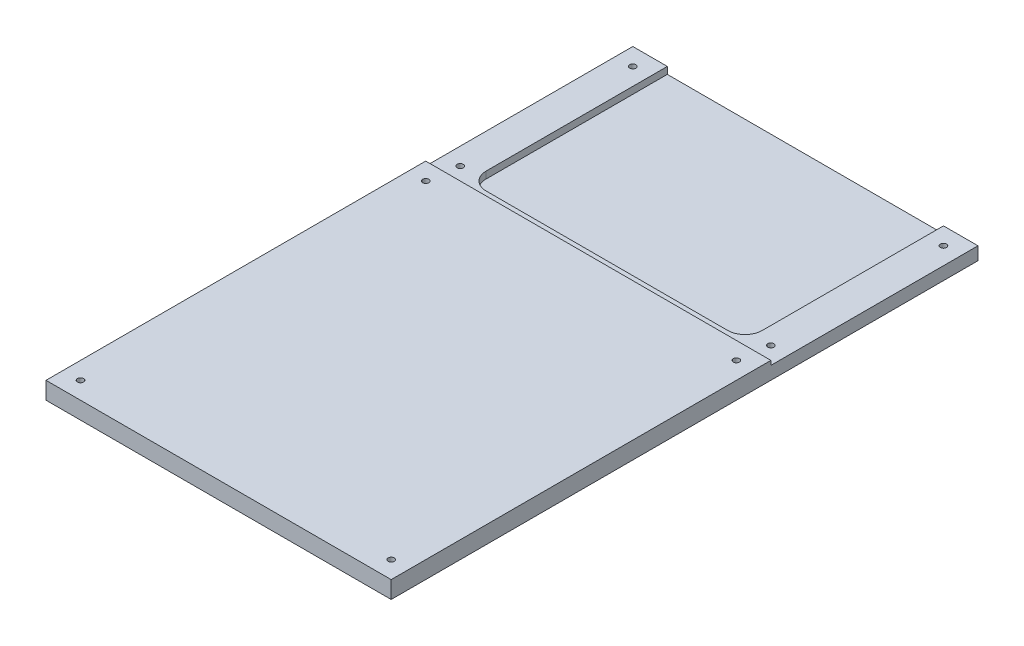
from build123d import *

# Parameters (mm, degrees)
SKETCH1_W                   = 127
SKETCH1_H                   = 215.9
BOSS_EXTRUDE1_DEPTH         = 6.35
SKETCH3_W                   = 127
SKETCH3_H                   = 76.2
CUT_EXTRUDE1_DEPTH          = 1.5875
F_43_0_089_DIAMETER_HOLE1_D = 2.2606
F_43_0_089_DIAMETER_HOLE2_D = 2.2606
SKETCH8_W                   = 101.6
SKETCH8_H                   = 73.025
CUT_EXTRUDE2_DEPTH          = 2.54
FILLET1_R                   = 6.35


with BuildPart() as part:
    # Sketch1 → Boss-Extrude1 (new body)
    with BuildSketch(Plane(origin=(0, 0, 0), x_dir=(1, 0, 0), z_dir=(0, 1, 0))):
        with Locations((63.5, 107.95)):
            Rectangle(SKETCH1_W, SKETCH1_H)
    extrude(amount=BOSS_EXTRUDE1_DEPTH)

    # Sketch3 → Cut-Extrude1 (cut)
    with BuildSketch(Plane(origin=(0, 6.35, 0), x_dir=(1, 0, 0), z_dir=(0, 1, 0))):
        with Locations((63.5, 177.8)):
            Rectangle(SKETCH3_W, SKETCH3_H)
    extrude(amount=-CUT_EXTRUDE1_DEPTH, mode=Mode.SUBTRACT)

    # #43 (0.089) Diameter Hole1 (through all)
    with Locations(Plane(origin=(0, 4.7625, 0), x_dir=(1, 0, 0), z_dir=(0, 1, 0))):
        with Locations((6.35, 209.55), (6.35, 146.05), (120.65, 146.05), (120.65, 209.55)):
            Hole(F_43_0_089_DIAMETER_HOLE1_D / 2)

    # #43 (0.089) Diameter Hole2 (through all)
    with Locations(Plane(origin=(0, 6.35, 0), x_dir=(1, 0, 0), z_dir=(0, 1, 0))):
        with Locations((6.35, 6.35), (120.65, 6.35), (6.35, 133.35), (120.65, 133.35)):
            Hole(F_43_0_089_DIAMETER_HOLE2_D / 2)

    # Sketch8 → Cut-Extrude2 (cut)
    with BuildSketch(Plane(origin=(0, 4.7625, 0), x_dir=(1, 0, 0), z_dir=(0, 1, 0))):
        with Locations((63.5, 179.3875)):
            Rectangle(SKETCH8_W, SKETCH8_H)
    extrude(amount=-CUT_EXTRUDE2_DEPTH, mode=Mode.SUBTRACT)

    # Fillet1
    fillet1_edges = [part.edges().sort_by_distance(p)[0] for p in [
        (12.7, 3.4925, -142.875),
        (114.3, 3.4925, -142.875),
    ]]
    fillet(fillet1_edges, radius=FILLET1_R)


solid = part.part
